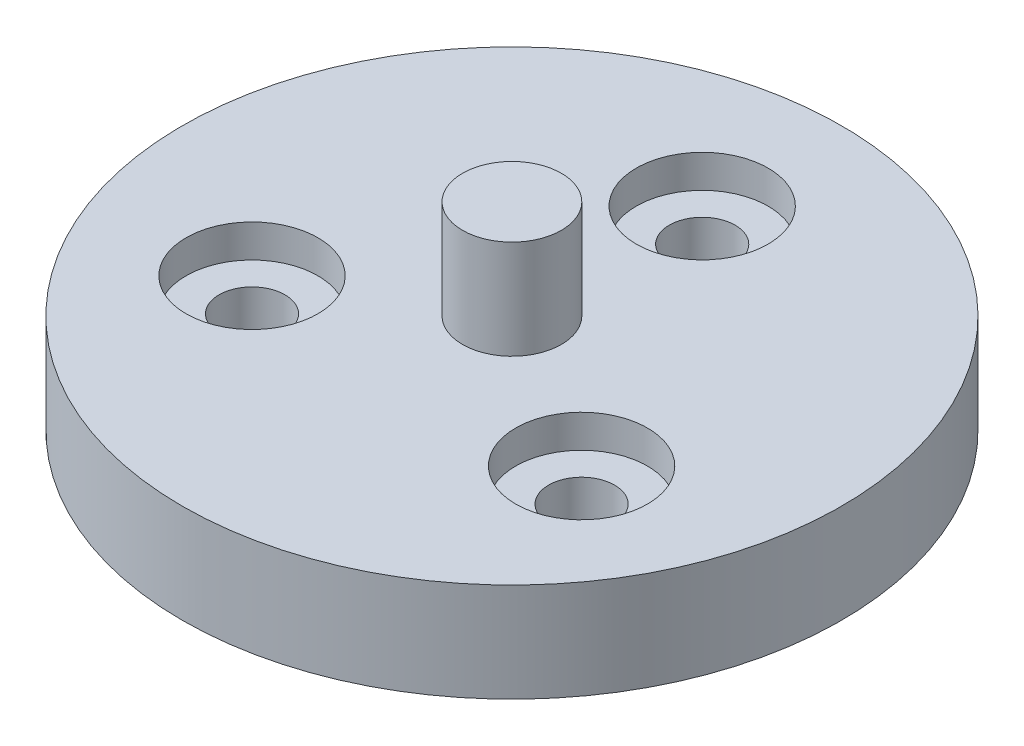
from build123d import *

# Parameters (mm, degrees)
SKETCH1_R           = 10
SKETCH1_R_2         = 1
BOSS_EXTRUDE1_DEPTH = 3
SKETCH2_R           = 2
CUT_EXTRUDE1_DEPTH  = 1
SKETCH4_R           = 1.5
BOSS_EXTRUDE2_DEPTH = 3


with BuildPart() as part:
    # Sketch1 → Boss-Extrude1 (new body)
    with BuildSketch(Plane(origin=(0, 0, 0), x_dir=(1, 0, 0), z_dir=(0, 1, 0))):
        with Locations(Location((0, 0, 0), (0, 0, 270))):
            Circle(SKETCH1_R)
        with Locations(Location((0, 5.773502692, 0), (0, 0, 270))):
            Circle(SKETCH1_R_2, mode=Mode.SUBTRACT)
        with Locations(Location((-5, -2.886751346, 0), (0, 0, 270))):
            Circle(SKETCH1_R_2, mode=Mode.SUBTRACT)
        with Locations(Location((5, -2.886751346, 0), (0, 0, 270))):
            Circle(SKETCH1_R_2, mode=Mode.SUBTRACT)
    extrude(amount=BOSS_EXTRUDE1_DEPTH)

    # Sketch2 → Cut-Extrude1 (cut)
    with BuildSketch(Plane(origin=(0, 3, 0), x_dir=(1, 0, 0), z_dir=(0, 1, 0))):
        with Locations(Location((0, 5.773502692, 0), (0, 0, 270))):
            Circle(SKETCH2_R)
        with Locations(Location((-5, -2.886751346, 0), (0, 0, 270))):
            Circle(SKETCH2_R)
        with Locations(Location((5, -2.886751346, 0), (0, 0, 270))):
            Circle(SKETCH2_R)
    extrude(amount=-CUT_EXTRUDE1_DEPTH, mode=Mode.SUBTRACT)

    # Sketch4 → Boss-Extrude2 (add)
    with BuildSketch(Plane(origin=(0, 3, 0), x_dir=(1, 0, 0), z_dir=(0, 1, 0))):
        with Locations(Location((0, 0, 0), (0, 0, 270))):
            Circle(SKETCH4_R)
    extrude(amount=BOSS_EXTRUDE2_DEPTH)


solid = part.part
